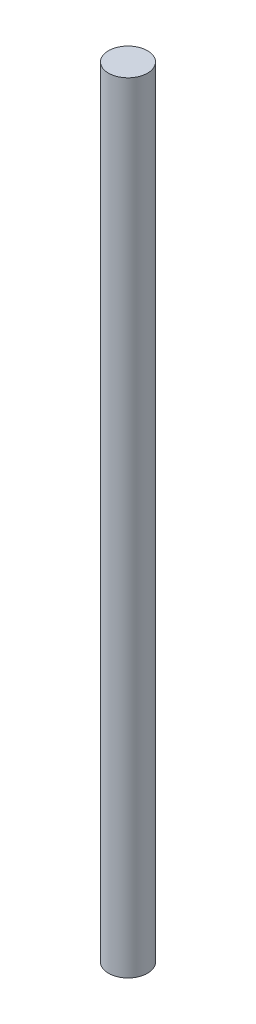
from build123d import *

# Parameters (mm, degrees)
SKETCH1_R           = 12.5
BOSS_EXTRUDE1_DEPTH = 500


with BuildPart() as part:
    # Sketch1 → Boss-Extrude1 (new body)
    with BuildSketch(Plane(origin=(0, 0, 0), x_dir=(1, 0, 0), z_dir=(0, 1, 0))):
        with Locations(Location((0, 0, 0), (0, 0, 270))):
            Circle(SKETCH1_R)
    extrude(amount=BOSS_EXTRUDE1_DEPTH)


solid = part.part
